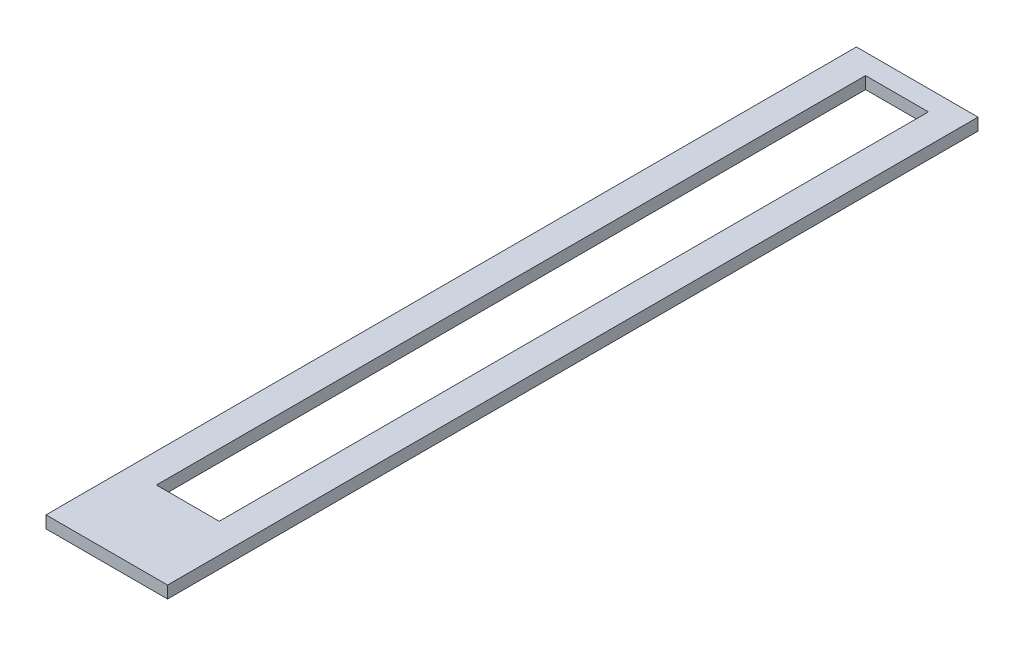
from build123d import *

# Parameters (mm, degrees)
ESBO_O1_W                = 30
ESBO_O1_H                = 200
RESSALTO_EXTRUS_O1_DEPTH = 3
ESBO_O2_W                = 15.5
ESBO_O2_H                = 175
CORTE_EXTRUS_O1_DEPTH    = 5


with BuildPart() as part:
    # Esboço1 → Ressalto-extrusão1 (new body)
    with BuildSketch(Plane(origin=(0, 0, 0), x_dir=(1, 0, 0), z_dir=(0, 1, 0))):
        Rectangle(ESBO_O1_W, ESBO_O1_H)
    extrude(amount=RESSALTO_EXTRUS_O1_DEPTH)

    # Esboço2 → Corte-extrusão1 (cut)
    with BuildSketch(Plane(origin=(0, 3, 0), x_dir=(1, 0, 0), z_dir=(0, 1, 0))):
        with Locations((0, 7.5)):
            Rectangle(ESBO_O2_W, ESBO_O2_H)
    extrude(amount=-CORTE_EXTRUS_O1_DEPTH, mode=Mode.SUBTRACT)


solid = part.part
